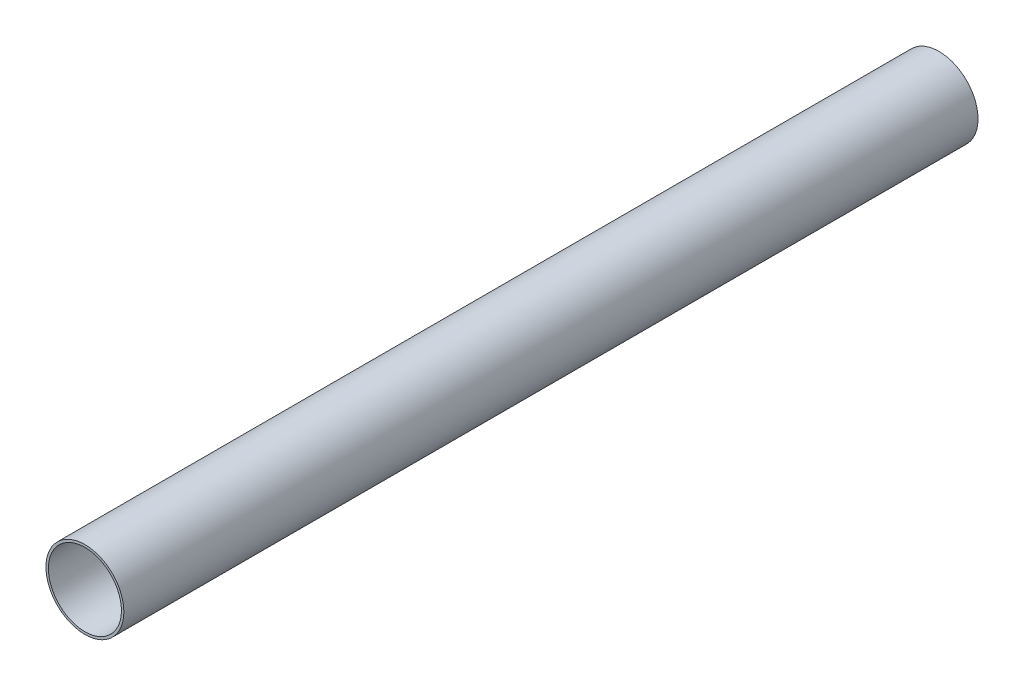
from build123d import *

# Parameters (mm, degrees)
SKETCH1_R           = 25.4
SKETCH1_R_2         = 23.8125
BOSS_EXTRUDE1_DEPTH = 278.375247287


with BuildPart() as part:
    # Sketch1 → Boss-Extrude1 (new, symmetric)
    with BuildSketch(Plane.XY):
        Circle(SKETCH1_R)
        Circle(SKETCH1_R_2, mode=Mode.SUBTRACT)
    extrude(amount=BOSS_EXTRUDE1_DEPTH, both=True)


solid = part.part
